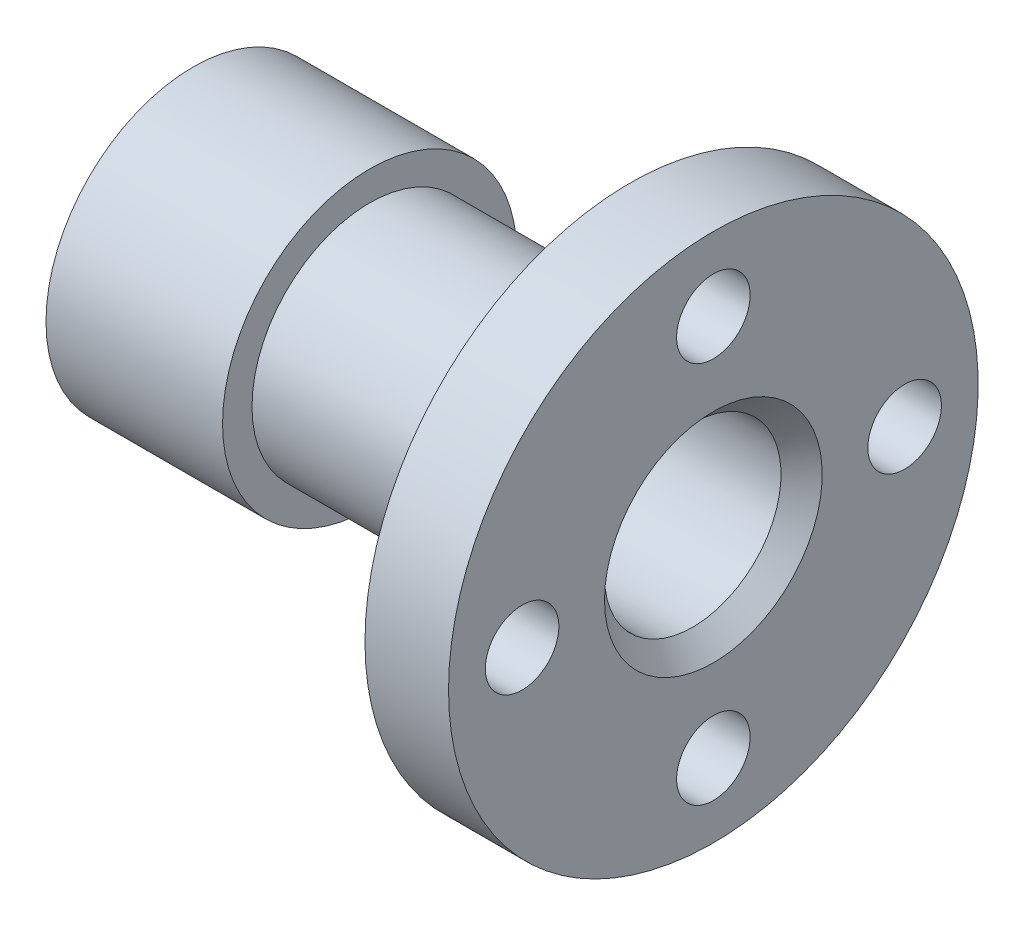
from build123d import *

# Parameters (mm, degrees)
CHAFL_N1_SIZE         = 3.5
CROQUIS2_R            = 6.25
CORTAR_EXTRUIR2_DEPTH = 27


with BuildPart() as part:
    # Croquis1 → Revolución1 (revolve)
    with BuildSketch(Plane.XY, mode=Mode.PRIVATE) as revoluci_n1_sk:
        Polygon((19.784615385, 15), (-44.615384615, 15), (-44.615384615, 19), (-68.615384615, 19), (-68.615384615, 25), (-38.615384615, 25), (-38.615384615, 20), (5.584615385, 20), (5.584615385, 45), (19.784615385, 45), align=None)
    revolve(revoluci_n1_sk.sketch.rotate(Axis((0, 0, 0), (1, 0, 0)), 90), axis=Axis((0, 0, 0), (1, 0, 0)))

    # Chaflán1
    chafl_n1_edges = [part.edges().sort_by_distance(p)[0] for p in [
        (19.784615385, 0, -15),
    ]]
    chamfer(chafl_n1_edges, length=CHAFL_N1_SIZE)

    # Croquis2 → Cortar-Extruir2 (cut)
    with BuildSketch(Plane.ZY.offset(-5.584615385)):
        with Locations((0, 32.5)):
            Circle(CROQUIS2_R)
        with Locations((0, -32.5)):
            Circle(CROQUIS2_R)
        with Locations((32.5, 0)):
            Circle(CROQUIS2_R)
        with Locations((-32.5, 0)):
            Circle(CROQUIS2_R)
    extrude(amount=-CORTAR_EXTRUIR2_DEPTH, mode=Mode.SUBTRACT)


solid = part.part
